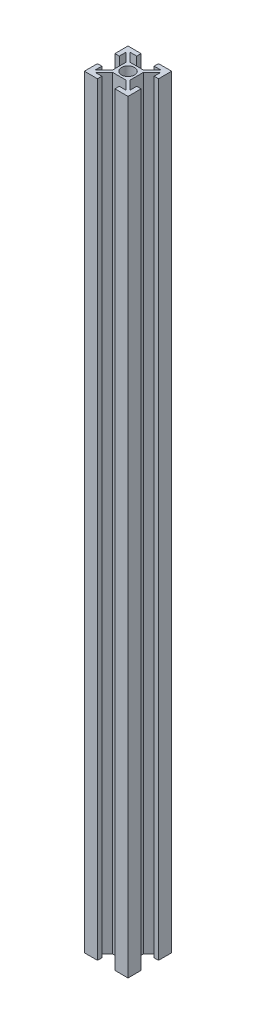
from build123d import *

# Parameters (mm, degrees)
F_2020_SKETCH_R     = 3
BOSS_EXTRUDE1_DEPTH = 350


with BuildPart() as part:
    # 2020 sketch → Boss-Extrude1 (new body)
    with BuildSketch(Plane(origin=(0, 0, 0), x_dir=(1, 0, 0), z_dir=(0, 1, 0))):
        Polygon((-4, 10), (-4, 8), (-7, 8), (-3, 4), (3, 4), (7, 8), (4, 8), (4, 10), (10, 10), (10, 4), (8, 4), (8, 7), (4, 3), (4, -3), (8, -7), (8, -4), (10, -4), (10, -10), (4, -10), (4, -8), (7, -8), (3, -4), (-3, -4), (-7, -8), (-4, -8), (-4, -10), (-10, -10), (-10, -4), (-8, -4), (-8, -7), (-4, -3), (-4, 3), (-8, 7), (-8, 4), (-10, 4), (-10, 10), align=None)
        with Locations(Location((0, 0, 0), (0, 0, 270))):
            Circle(F_2020_SKETCH_R, mode=Mode.SUBTRACT)
    extrude(amount=BOSS_EXTRUDE1_DEPTH)


solid = part.part
